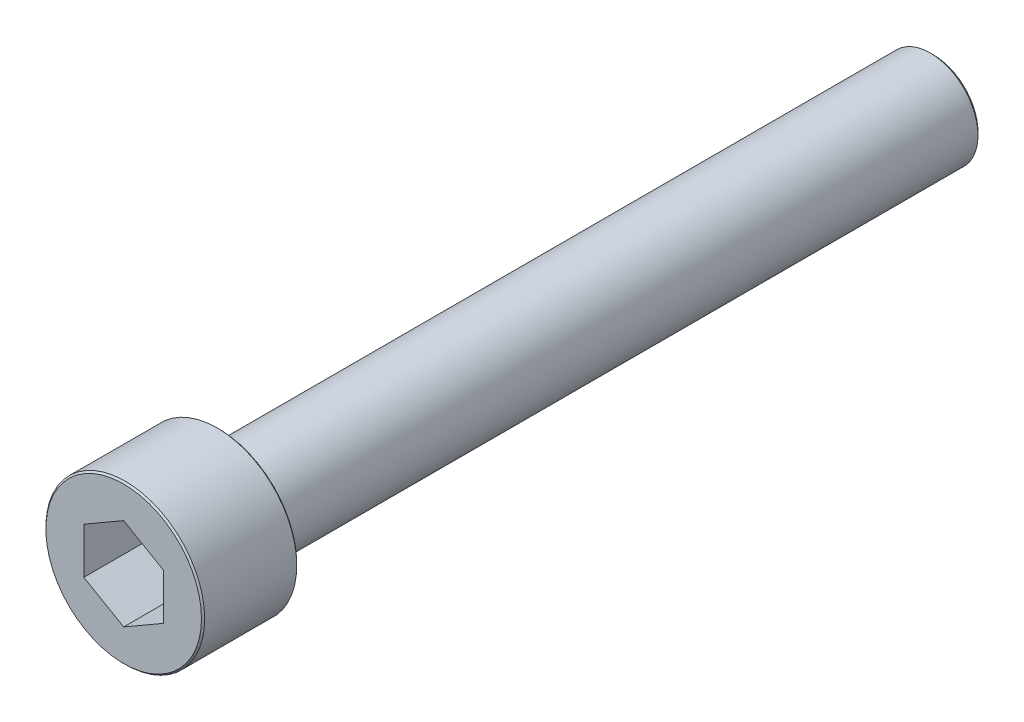
from build123d import *

# Parameters (mm, degrees)
SKETCH_1_W          = 5
SKETCH_1_H          = 6
SKETCH_2_R          = 3
EXTRUDE_1_DEPTH     = 45
CUT_EXTRUDE_1_DEPTH = 4.5
CHAMFER_1_SIZE2     = 0.100043834
CHAMFER_1_SIZE      = 0.100042957
CHAMFER_2_SIZE      = 0.20006968
CHAMFER_2_SIZE2     = 0.200074659


with BuildPart() as part:
    # 草图1 → 旋转1 (revolve)
    with BuildSketch(Plane(origin=(0, 0, 0), x_dir=(1, 0, 0), z_dir=(0, 1, 0))):
        with Locations((2.5, -48)):
            Rectangle(SKETCH_1_W, SKETCH_1_H)
    revolve(axis=Axis((0, 0, 45), (0, 0, 1)))

    # 草图2 → 凸台-拉伸1 (add)
    with BuildSketch(Plane(origin=(0, 0, 45), x_dir=(-1, 0, 0), z_dir=(0, 0, -1))):
        with Locations(Location((0, 0, 0), (0, 0, 180))):
            Circle(SKETCH_2_R)
    extrude(amount=EXTRUDE_1_DEPTH)

    # 草图3 → 切除-拉伸1 (cut)
    with BuildSketch(Plane.XY.offset(51)):
        Polygon((-2.51, -1.449149176), (0, -2.898298351), (2.51, -1.449149176), (2.51, 1.449149176), (0, 2.898298351), (-2.51, 1.449149176), align=None)
    extrude(amount=-CUT_EXTRUDE_1_DEPTH, mode=Mode.SUBTRACT)

    # 倒角1
    chamfer_1_edges = [part.edges().sort_by_distance(p)[0] for p in [
        (-5, 0, 51),
        (-5, 0, 45),
    ]]
    chamfer(chamfer_1_edges, length=CHAMFER_1_SIZE, length2=CHAMFER_1_SIZE2)

    # 倒角2
    chamfer_2_edges = [part.edges().sort_by_distance(p)[0] for p in [
        (-3, 0, 0),
    ]]
    chamfer_2_side = [part.faces().sort_by_distance(p)[0] for p in [
        (-3, 0, 22.5),
    ]]
    chamfer(chamfer_2_edges, length=CHAMFER_2_SIZE, length2=CHAMFER_2_SIZE2, reference=chamfer_2_side[0])


solid = part.part
